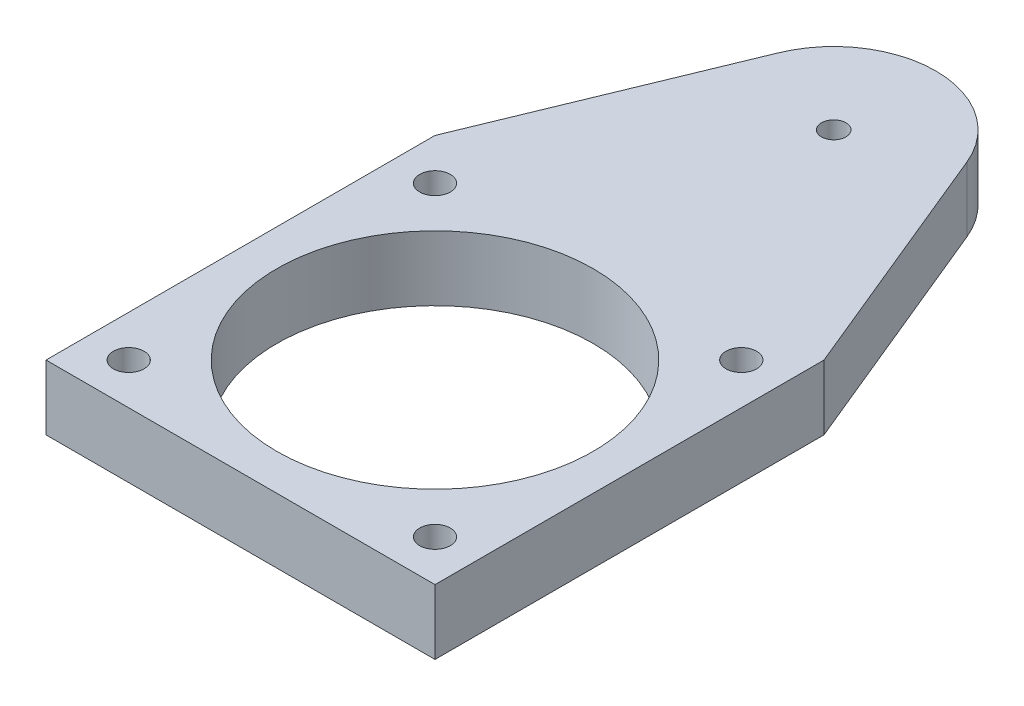
from build123d import *

# Parameters (mm, degrees)
SKETCH1_R           = 1.5
SKETCH1_R_2         = 15.5
SKETCH1_R_3         = 1.2
BOSS_EXTRUDE1_DEPTH = 6.35


with BuildPart() as part:
    # Sketch1 → Boss-Extrude1 (new body)
    with BuildSketch(Plane(origin=(0, 0, 0), x_dir=(1, 0, 0), z_dir=(0, 1, 0))):
        with BuildLine():
            Line((0, 0), (38.1, 0))
            Line((38.1, 0), (38.1, 38.1))
            Line((38.1, 38.1), (28.296762992, 61.90754175))
            ThreePointArc((28.296762992, 61.90754175), (19.05, 68.1), (9.803237008, 61.90754175))
            Line((9.803237008, 61.90754175), (0, 38.1))
            Line((0, 38.1), (0, 0))
        make_face()
        with Locations(Location((4.05, 4.05, 0), (0, 0, 270))):
            Circle(SKETCH1_R, mode=Mode.SUBTRACT)
        with Locations(Location((34.05, 4.05, 0), (0, 0, 270))):
            Circle(SKETCH1_R, mode=Mode.SUBTRACT)
        with Locations(Location((34.05, 34.05, 0), (0, 0, 270))):
            Circle(SKETCH1_R, mode=Mode.SUBTRACT)
        with Locations(Location((4.05, 34.05, 0), (0, 0, 270))):
            Circle(SKETCH1_R, mode=Mode.SUBTRACT)
        with Locations(Location((19.05, 19.05, 0), (0, 0, 270))):
            Circle(SKETCH1_R_2, mode=Mode.SUBTRACT)
        with Locations(Location((19.05, 58.1, 0), (0, 0, 270))):
            Circle(SKETCH1_R_3, mode=Mode.SUBTRACT)
    extrude(amount=BOSS_EXTRUDE1_DEPTH)


solid = part.part
